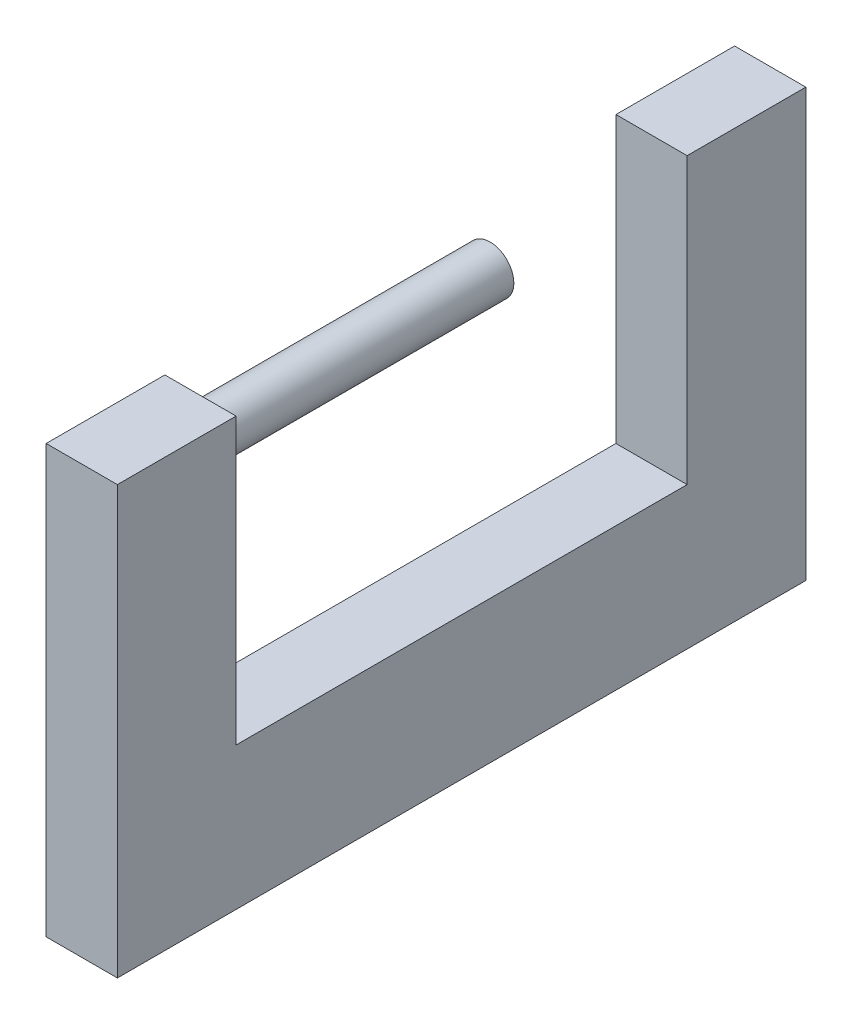
from build123d import *

# Parameters (mm, degrees)
BOSS_EXTRUDE1_DEPTH = 15
SKETCH2_R           = 5
BOSS_EXTRUDE2_DEPTH = 61


with BuildPart() as part:
    # Sketch1 → Boss-Extrude1 (new body)
    with BuildSketch(Plane.YZ):
        Polygon((0, 0), (0, 95), (60, 95), (60, 120), (-30, 120), (-30, -25), (60, -25), (60, 0), align=None)
    extrude(amount=BOSS_EXTRUDE1_DEPTH)

    # Sketch2 → Boss-Extrude2 (add)
    with BuildSketch(Plane(origin=(0, 0, 95), x_dir=(1, 0, 0), z_dir=(0, 0, -1))):
        with Locations(Location((7.5, -52.5, 0), (0, 0, 90))):
            Circle(SKETCH2_R)
    extrude(amount=BOSS_EXTRUDE2_DEPTH)


solid = part.part
